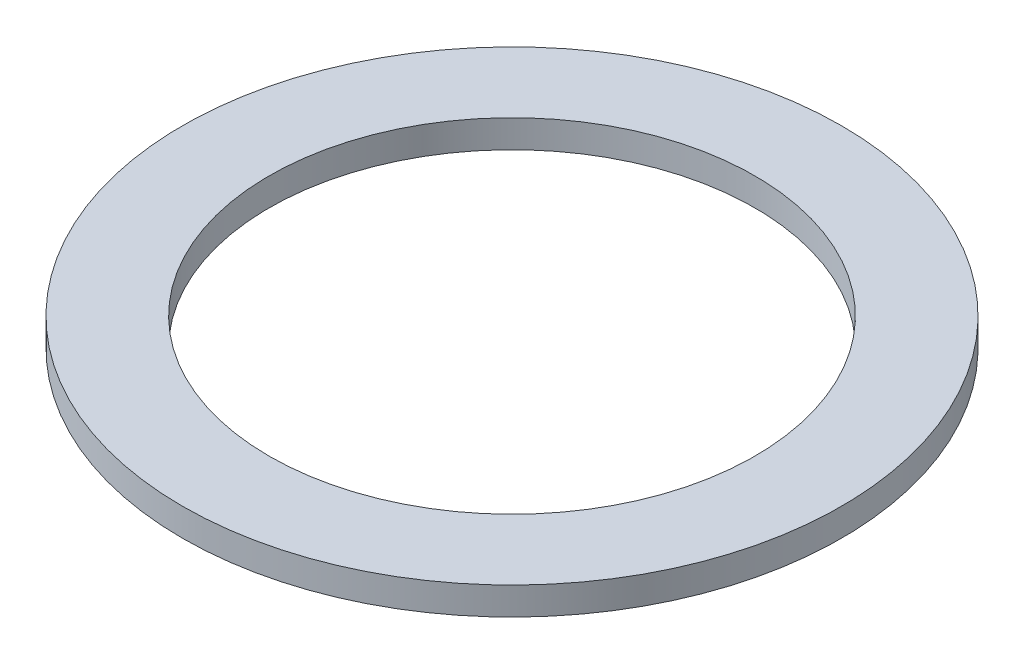
from build123d import *

# Parameters (mm, degrees)
SKETCH1_R           = 47.5
SKETCH1_R_2         = 35
BOSS_EXTRUDE1_DEPTH = 4


with BuildPart() as part:
    # Sketch1 → Boss-Extrude1 (new body)
    with BuildSketch(Plane(origin=(0, 0, 0), x_dir=(1, 0, 0), z_dir=(0, 1, 0))):
        with Locations(Location((0, 0, 0), (0, 0, 270))):
            Circle(SKETCH1_R)
        with Locations(Location((0, 0, 0), (0, 0, 270))):
            Circle(SKETCH1_R_2, mode=Mode.SUBTRACT)
    extrude(amount=BOSS_EXTRUDE1_DEPTH)


solid = part.part
